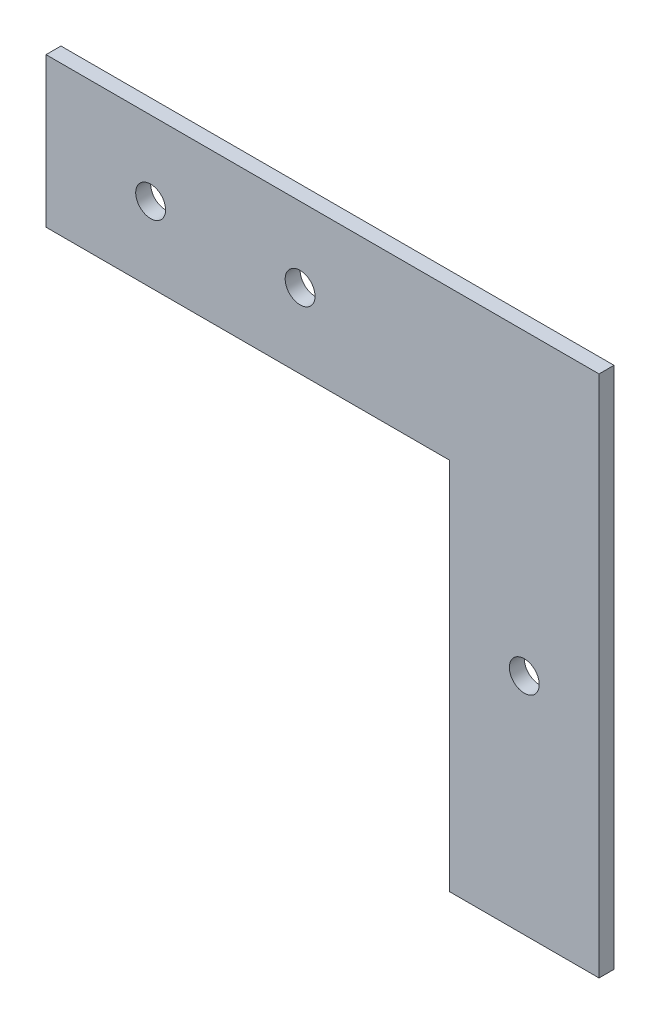
from build123d import *

# Parameters (mm, degrees)
SKETCH_1_R      = 2
EXTRUDE_1_DEPTH = 2


with BuildPart() as part:
    # 草图1 → 凸台-拉伸1 (new body)
    with BuildSketch(Plane.XY):
        Polygon((-55.685696482, 27.560346603), (-55.685696482, 7.560346603), (-1.685696482, 7.560346603), (-1.685696482, -42.439653397), (18.314303518, -42.439653397), (18.314303518, 27.560346603), align=None)
        with Locations((8.314303518, -12.439653397)):
            Circle(SKETCH_1_R, mode=Mode.SUBTRACT)
        with Locations((-21.685696483, 17.560346603)):
            Circle(SKETCH_1_R, mode=Mode.SUBTRACT)
        with Locations((-41.685696483, 17.560346603)):
            Circle(SKETCH_1_R, mode=Mode.SUBTRACT)
    extrude(amount=EXTRUDE_1_DEPTH)


solid = part.part
